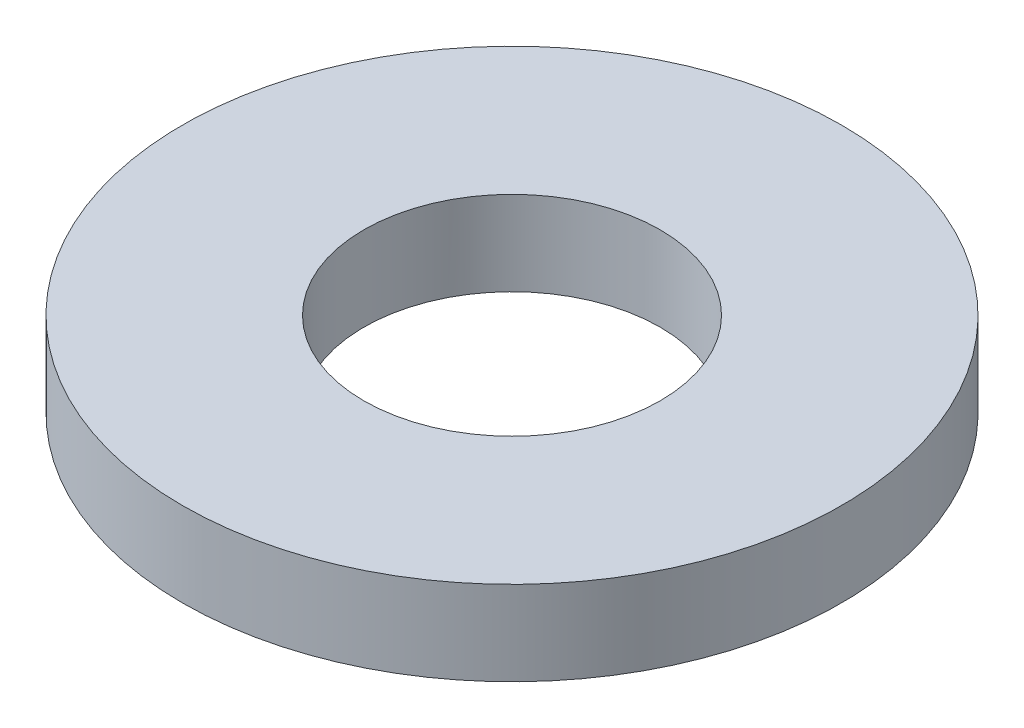
from build123d import *

# Parameters (mm, degrees)
SKETCH1_R           = 7.9375
BOSS_EXTRUDE2_DEPTH = 2.032
SKETCH3_R           = 3.5687
CUT_EXTRUDE1_DEPTH  = 3.302


with BuildPart() as part:
    # Sketch1 → Boss-Extrude2 (new body)
    with BuildSketch(Plane(origin=(0, 0, 0), x_dir=(1, 0, 0), z_dir=(0, 1, 0))):
        with Locations(Location((0, 0, 0), (0, 0, 270))):
            Circle(SKETCH1_R)
    extrude(amount=BOSS_EXTRUDE2_DEPTH)

    # Sketch3 → Cut-Extrude1 (cut)
    with BuildSketch(Plane(origin=(0, 0, 0), x_dir=(-1, 0, 0), z_dir=(0, -1, 0))):
        with Locations(Location((0, 0, 0), (0, 0, 90))):
            Circle(SKETCH3_R)
    extrude(amount=-CUT_EXTRUDE1_DEPTH, mode=Mode.SUBTRACT)


solid = part.part
